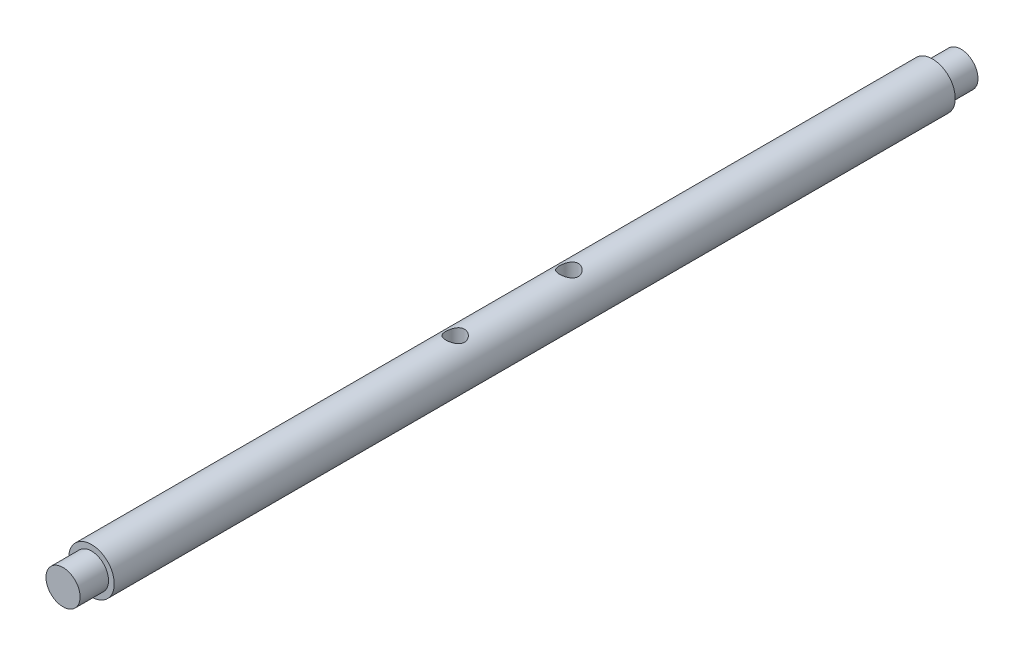
from build123d import *

# Parameters (mm, degrees)
SKETCH_1_R               = 4
EXTRUDE_1_DEPTH          = 147.8
SKETCH_2_R               = 3
EXTRUDE_2_DEPTH          = 5
CUT_EXTRUDE_1_DEPTH      = 153.904676187
CUT_EXTRUDE_1_DEPTH_BACK = 153.904676187
SKETCH_3_R               = 1.65


with BuildPart() as part:
    # ｽｹｯﾁ1 → ﾎﾞｽ - 押し出し1 (new body)
    with BuildSketch(Plane.XY):
        Circle(SKETCH_1_R)
    extrude(amount=EXTRUDE_1_DEPTH)

    # ｽｹｯﾁ2 → ﾎﾞｽ - 押し出し2 (add)
    with BuildSketch(Plane.XY.offset(147.8)):
        Circle(SKETCH_2_R)
    extrude_2 = extrude(amount=EXTRUDE_2_DEPTH)

    # ﾐﾗｰ1: ﾎﾞｽ - 押し出し2 across plane
    add(extrude_2.mirror(Plane.XY.offset(73.9)))

    # ｽｹｯﾁ3 → ｶｯﾄ - 押し出し1 (cut, two sides: drawn at the far end of the back side and taken through both)
    with BuildSketch(Plane(origin=(0, 0, 0), x_dir=(1, 0, 0), z_dir=(0, 1, 0)).offset(-CUT_EXTRUDE_1_DEPTH_BACK)):
        with Locations(Location((0, -63.9, 0), (0, 0, 270))):
            Circle(SKETCH_3_R)
        with Locations(Location((0, -83.9, 0), (0, 0, 270))):
            Circle(SKETCH_3_R)
    extrude(amount=CUT_EXTRUDE_1_DEPTH + CUT_EXTRUDE_1_DEPTH_BACK, mode=Mode.SUBTRACT)


solid = part.part
